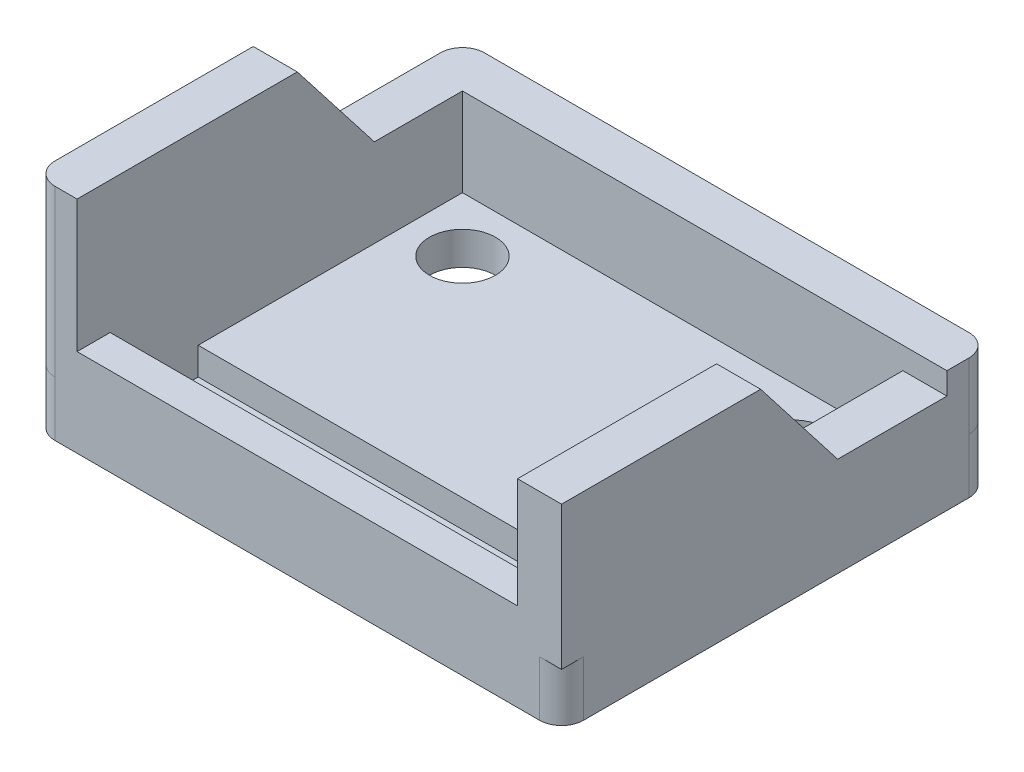
from build123d import *

# Parameters (mm, degrees)
SKETCH3_W            = 10
SKETCH3_H            = 12
SKETCH3_R            = 1.5
BOSS_EXTRUDE2_DEPTH  = 1.5
SKETCH3_5_W          = 20
SKETCH3_5_H          = 1.5
BOSS_EXTRUDE4_DEPTH  = 4
SKETCH3_6_W          = 10
SKETCH3_6_H          = 4
BOSS_EXTRUDE5_DEPTH  = 0.25
BOSS_EXTRUDE7_DEPTH  = 2.5
BOSS_EXTRUDE10_DEPTH = 2
BOSS_EXTRUDE11_DEPTH = 24
FILLET5_R            = 1
FILLET6_R            = 1
BOSS_EXTRUDE12_DEPTH = 2


with BuildPart() as part:
    # Sketch3 → Boss-Extrude2 (new body)
    # profile 1 of 2: a face of its own
    with BuildSketch(Plane(origin=(0, 0, 0), x_dir=(1, 0, 0), z_dir=(0, 1, 0))):
        with Locations((7, 11.5)):
            Rectangle(SKETCH3_W, SKETCH3_H)
        with Locations(Location((4.5, 15, 0), (0, 0, 270))):
            Circle(SKETCH3_R, mode=Mode.SUBTRACT)
    # profile 2 of 2: a face of its own
    with BuildSketch(Plane(origin=(0, 0, 0), x_dir=(1, 0, 0), z_dir=(0, 1, 0))):
        with Locations((17, 11.5)):
            Rectangle(SKETCH3_W, SKETCH3_H)
        with Locations(Location((19.5, 15, 0), (0, 0, 270))):
            Circle(SKETCH3_R, mode=Mode.SUBTRACT)
    extrude(amount=BOSS_EXTRUDE2_DEPTH)

    # Sketch3<6> → Boss-Extrude5 (add)
    with BuildSketch(Plane(origin=(0, 0, 0), x_dir=(1, 0, 0), z_dir=(0, 1, 0))):
        with Locations((17, 3.5)):
            Rectangle(SKETCH3_6_W, SKETCH3_6_H)
        with Locations((7, 3.5)):
            Rectangle(SKETCH3_6_W, SKETCH3_6_H)
    extrude(amount=BOSS_EXTRUDE5_DEPTH)



with BuildPart() as body_2:
    # Sketch3<5> → Boss-Extrude4 (new body)
    with BuildSketch(Plane(origin=(0, 0, 0), x_dir=(1, 0, 0), z_dir=(0, 1, 0))):
        with Locations((12, 0.75)):
            Rectangle(SKETCH3_5_W, SKETCH3_5_H)
    extrude(amount=BOSS_EXTRUDE4_DEPTH)


with BuildPart() as part_1:
    add(part.part)

    add(body_2.part)  # Boss-Extrude7 merges body 2
    # Sketch3<8> → Boss-Extrude7 (add)
    with BuildSketch(Plane(origin=(0, 0, 0), x_dir=(1, 0, 0), z_dir=(0, 1, 0))):
        with BuildLine():
            ThreePointArc((0, 1), (0.292893219, 0.292893219), (1, 0))
            Line((1, 0), (2, 0))
            Line((2, 0), (2, 1.5))
            Line((2, 1.5), (2, 5.5))
            Line((2, 5.5), (2, 17.5))
            Line((2, 17.5), (22, 17.5))
            Line((22, 17.5), (22, 5.5))
            Line((22, 5.5), (22, 1.5))
            Line((22, 1.5), (22, 0))
            Line((22, 0), (23, 0))
            ThreePointArc((23, 0), (23.707106781, 0.292893219), (24, 1))
            Line((24, 1), (24, 18.5))
            ThreePointArc((24, 18.5), (23.707106781, 19.207106781), (23, 19.5))
            Line((23, 19.5), (1, 19.5))
            ThreePointArc((1, 19.5), (0.292893219, 19.207106781), (0, 18.5))
            Line((0, 18.5), (0, 1))
        make_face()
    extrude(amount=BOSS_EXTRUDE7_DEPTH)

    # Sketch9 → Boss-Extrude10 (add)
    with BuildSketch(Plane(origin=(0, 0, 0), x_dir=(0, 0, -1), z_dir=(1, 0, 0))):
        Polygon((0, 2.5), (17.5, 2.5), (17.5, 5.5), (13.5, 5.5), (10, 10), (0, 10), align=None)
    extrude(amount=BOSS_EXTRUDE10_DEPTH)

    # Sketch4 → Boss-Extrude11 (add, through all)
    with BuildSketch(Plane(origin=(24, 0, 0), x_dir=(0, 0, -1), z_dir=(1, 0, 0))):
        Polygon((18.5, 2.5), (19.5, 2.5), (19.5, 5.5), (17.5, 5.5), (17.5, 4.5), (17.5, 2.5), align=None)
    extrude(amount=-BOSS_EXTRUDE11_DEPTH)

    # Fillet5
    fillet5_edges = [part_1.edges().sort_by_distance(p)[0] for p in [
        (24, 4, -19.5),
        (0, 4, -19.5),
    ]]
    fillet(fillet5_edges, radius=FILLET5_R)

    # Fillet6
    fillet6_edges = [part_1.edges().sort_by_distance(p)[0] for p in [
        (0, 6.25, 0),
    ]]
    fillet(fillet6_edges, radius=FILLET6_R)

    # Sketch4<4> → Boss-Extrude12 (add)
    with BuildSketch(Plane(origin=(24, 0, 0), x_dir=(0, 0, -1), z_dir=(1, 0, 0))):
        Polygon((0, 2.5), (17.5, 2.5), (17.5, 4.5), (12.540039711, 4.5), (9.040667866, 9), (0, 9), align=None)
    extrude(amount=-BOSS_EXTRUDE12_DEPTH)


solid = part_1.part
